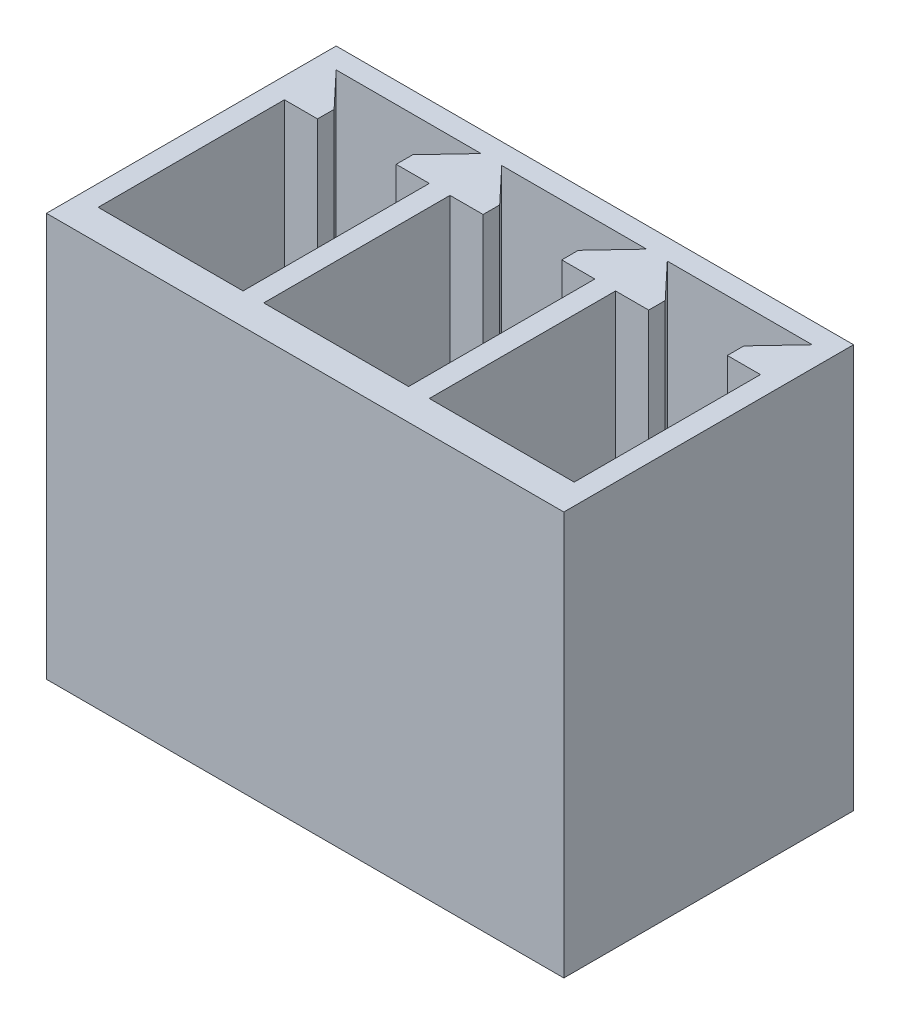
from build123d import *

# Parameters (mm, degrees)
SKETCH1_W           = 12.5
SKETCH1_H           = 7
BOSS_EXTRUDE1_DEPTH = 9.25
SKETCH2_W           = 12.5
SKETCH2_H           = 7
BOSS_EXTRUDE2_DEPTH = 0.5


with BuildPart() as part:
    # Sketch1 → Boss-Extrude1 (new body)
    with BuildSketch(Plane(origin=(0, 0, 0), x_dir=(1, 0, 0), z_dir=(0, 1, 0))):
        with Locations((0, 3.5)):
            Rectangle(SKETCH1_W, SKETCH1_H)
        Polygon((-5.75, 5.25), (-5.75, 0.75), (-2.25, 0.75), (-2.25, 5.25), (-3.05, 5.25), (-3.05, 5.65), (-2.25, 6.5), (-5.75, 6.5), (-4.95, 5.65), (-4.95, 5.25), align=None, mode=Mode.SUBTRACT)
        Polygon((-1.75, 5.25), (-1.75, 0.75), (1.75, 0.75), (1.75, 5.25), (0.95, 5.25), (0.95, 5.65), (1.75, 6.5), (-1.75, 6.5), (-0.95, 5.65), (-0.95, 5.25), align=None, mode=Mode.SUBTRACT)
        Polygon((2.25, 5.25), (2.25, 0.75), (5.75, 0.75), (5.75, 5.25), (4.95, 5.25), (4.95, 5.65), (5.75, 6.5), (2.25, 6.5), (3.05, 5.65), (3.05, 5.25), align=None, mode=Mode.SUBTRACT)
    extrude(amount=BOSS_EXTRUDE1_DEPTH)

    # Sketch2 → Boss-Extrude2 (add)
    with BuildSketch(Plane.XZ):
        with Locations((0, -3.5)):
            Rectangle(SKETCH2_W, SKETCH2_H)
    extrude(amount=BOSS_EXTRUDE2_DEPTH)


solid = part.part
